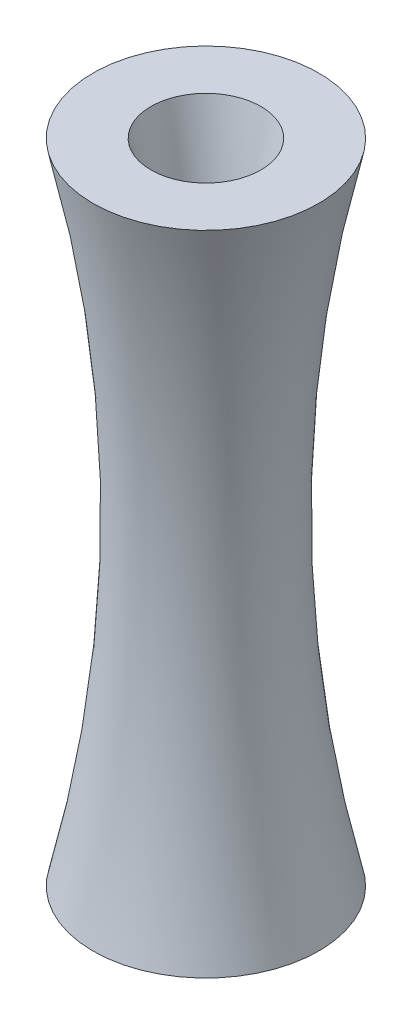
from build123d import *

# Parameters (mm, degrees)
SHELL_1_T = -4


with BuildPart() as part:
    # 草图1 → 旋转1 (revolve)
    with BuildSketch(Plane.XY, mode=Mode.PRIVATE) as revolve_1_sk:
        with BuildLine():
            Line((0, 0), (8.014568765, 0))
            ThreePointArc((8.014568765, 0), (5.278354632, 22.975097125), (8.014568765, 45.95019425))
            Line((8.014568765, 45.95019425), (0, 45.95019425))
            Line((0, 45.95019425), (0, 0))
        make_face()
    revolve(revolve_1_sk.sketch.rotate(Axis((0, 45.95019425, 0), (0, -1, 0)), 90), axis=Axis((0, 45.95019425, 0), (0, -1, 0)))

    # 抽壳1
    shell_1_openings = [part.faces().sort_by_distance(p)[0] for p in [
        (0, 45.95019425, 0),
        (0, 0, 0),
    ]]
    offset(amount=SHELL_1_T, openings=shell_1_openings, kind=Kind.INTERSECTION)


solid = part.part
